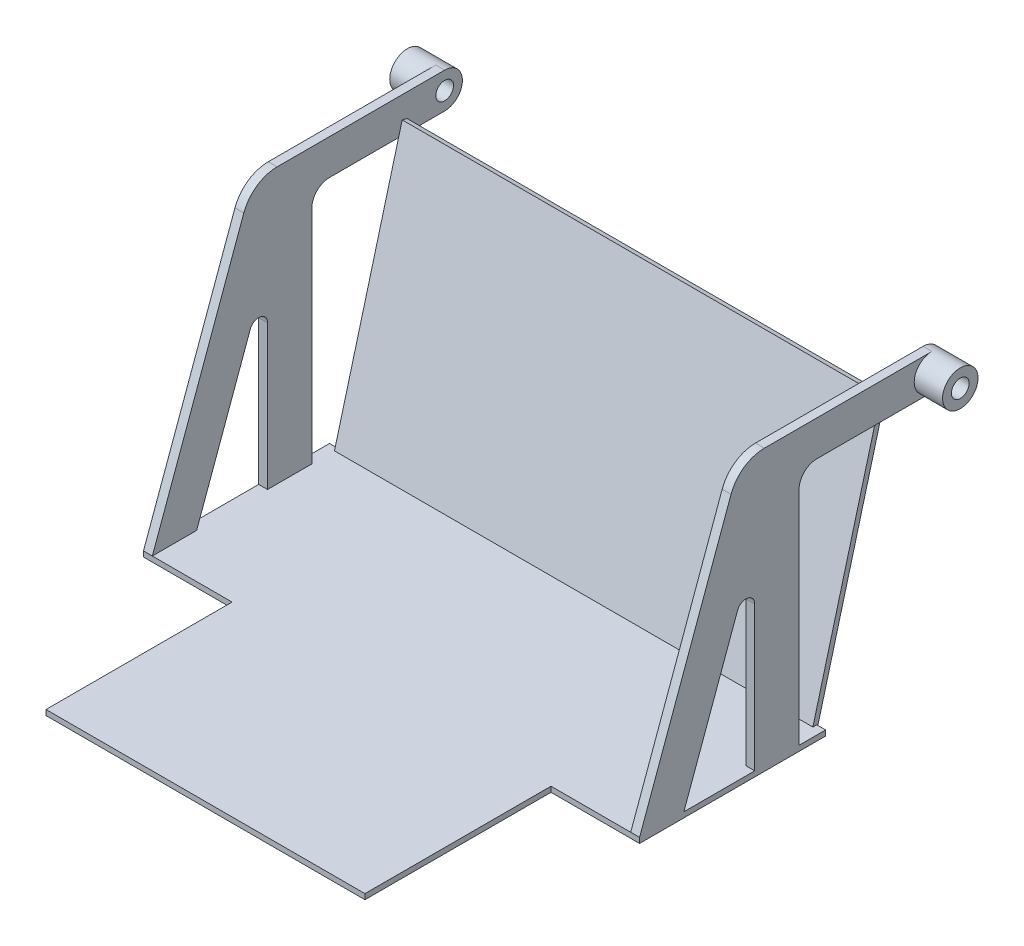
from build123d import *
from build123d.topology import SkipClean

# Parameters (mm, degrees)
BOSS_EXTRUDE1_DEPTH     = 3
BOSS_EXTRUDE2_DEPTH     = 280
CUT_EXTRUDE2_DEPTH      = 385.010416525
CUT_EXTRUDE2_DEPTH_BACK = 385.010416525
SKETCH3_W               = 270
SKETCH3_H               = 200
CUT_EXTRUDE3_DEPTH      = 385.010416525
CUT_EXTRUDE3_DEPTH_BACK = 385.010416525
SKETCH4_R               = 5
BOSS_EXTRUDE3_START     = 16
SKETCH5_R               = 10
SKETCH5_R_2             = 5
BOSS_EXTRUDE3_DEPTH     = 16
SKETCH6_R               = 10
SKETCH6_R_2             = 5
BOSS_EXTRUDE4_DEPTH     = 16
BOSS_EXTRUDE5_DEPTH     = 270


with BuildPart() as part:
    # Sketch1 → Boss-Extrude1 (new body)
    with BuildSketch(Plane(origin=(0, 0, 0), x_dir=(1, 0, 0), z_dir=(0, 1, 0))):
        Polygon((0, 0), (280, 0), (280, -100), (230, -100), (230, -210), (50, -210), (50, -100), (0, -100), align=None)
    extrude(amount=BOSS_EXTRUDE1_DEPTH)

    # Sketch2 → Boss-Extrude2 (add, through all)
    with BuildSketch(Plane.ZY):
        with BuildLine():
            Line((15, 0), (15, 3))
            Line((15, 3), (15, 128))
            ThreePointArc((15, 128), (12.071067812, 135.071067812), (5, 138))
            Line((5, 138), (-60, 138))
            ThreePointArc((-60, 138), (-70, 148), (-60, 158))
            Line((-60, 158), (34.580462925, 158))
            ThreePointArc((34.580462925, 158), (46.051991652, 154.383040886), (53.37431534, 144.840402867))
            Line((53.37431534, 144.840402867), (105, 3))
            Line((105, 3), (105, 0))
            Line((105, 0), (80, 0))
            Line((80, 0), (80, 3))
            Line((80, 3), (49.698463104, 86.252788397))
            ThreePointArc((49.698463104, 86.252788397), (44.131759112, 89.466726445), (40, 84.54268768))
            Line((40, 84.54268768), (40, 3))
            Line((40, 3), (40, 0))
            Line((40, 0), (15, 0))
        make_face()
    extrude(amount=-BOSS_EXTRUDE2_DEPTH)

    # Sketch3 → Cut-Extrude2 (cut, two sides: drawn at the far end of the back side and taken through both)
    with BuildSketch(Plane(origin=(0, 0, 0), x_dir=(-1, 0, 0), z_dir=(0, 0, -1)).offset(-CUT_EXTRUDE2_DEPTH_BACK)):
        with Locations((-140, 103)):
            Rectangle(SKETCH3_W, SKETCH3_H)
    extrude(amount=CUT_EXTRUDE2_DEPTH + CUT_EXTRUDE2_DEPTH_BACK, mode=Mode.SUBTRACT)

    # Sketch4 → Cut-Extrude3 (cut, two sides: drawn at the far end of the back side and taken through both)
    with BuildSketch(Plane.ZY.offset(-CUT_EXTRUDE3_DEPTH_BACK)):
        with Locations((-60, 148)):
            Circle(SKETCH4_R)
    extrude(amount=CUT_EXTRUDE3_DEPTH + CUT_EXTRUDE3_DEPTH_BACK, mode=Mode.SUBTRACT)

    # Sketch5 → Boss-Extrude3 (add)
    with SkipClean():  # the faces are left unmerged after this step: merging them gives an invalid solid
        with BuildSketch(Plane.ZY.offset(BOSS_EXTRUDE3_START)):
            with Locations((-60, 148)):
                Circle(SKETCH5_R)
            with Locations((-60, 148)):
                Circle(SKETCH5_R_2, mode=Mode.SUBTRACT)
        extrude(amount=-BOSS_EXTRUDE3_DEPTH)

    # Sketch6 → Boss-Extrude4 (add)
    with SkipClean():  # the faces are left unmerged after this step: merging them gives an invalid solid
        with BuildSketch(Plane(origin=(280, 0, 0), x_dir=(0, 0, -1), z_dir=(1, 0, 0))):
            with Locations(Location((60, 148, 0), (0, 0, 90))):
                Circle(SKETCH6_R)
            with Locations((60, 148)):
                Circle(SKETCH6_R_2, mode=Mode.SUBTRACT)
        extrude(amount=BOSS_EXTRUDE4_DEPTH)

    # Sketch7 → Boss-Extrude5 (add)
    with SkipClean():  # the faces are left unmerged after this step: merging them gives an invalid solid
        with BuildSketch(Plane(origin=(5, 0, 0), x_dir=(0, 0, -1), z_dir=(1, 0, 0))):
            Polygon((0, 0), (-3, 0), (36.02381866, 145.638873943), (38.822856765, 144.888873943), align=None)
        extrude(amount=BOSS_EXTRUDE5_DEPTH)


solid = part.part
